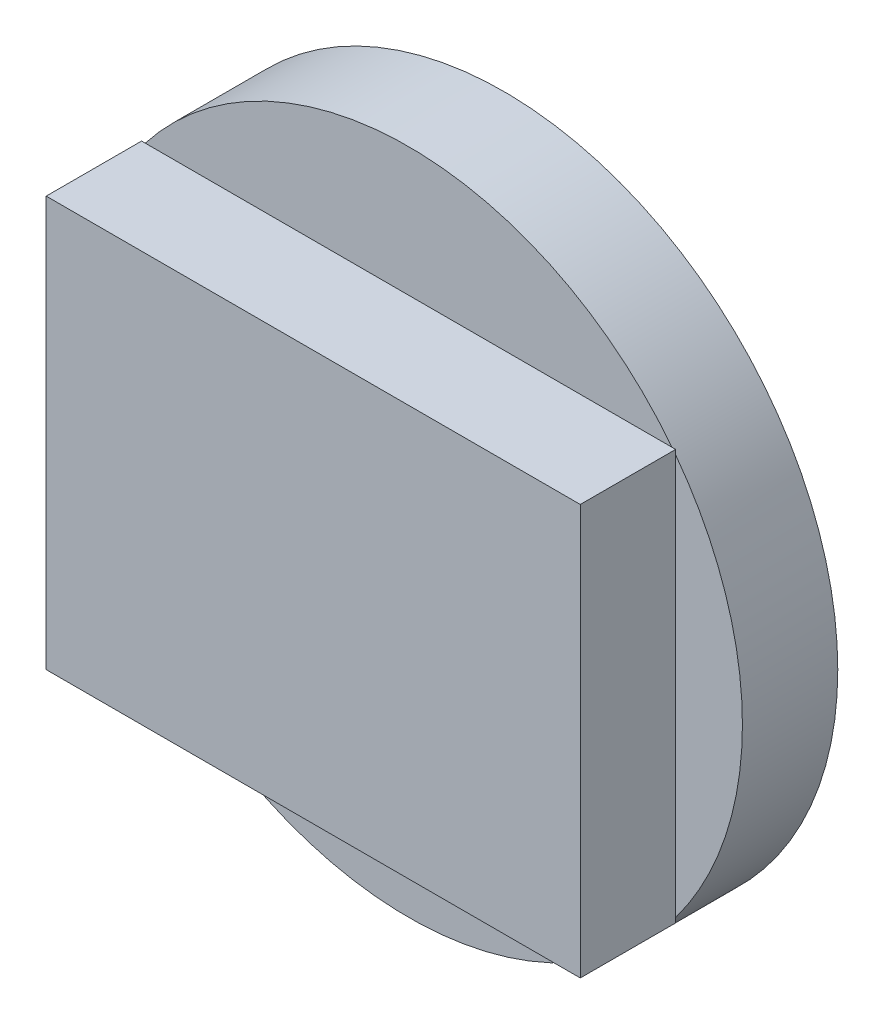
from build123d import *

# Parameters (mm, degrees)
ESQUISSE1_W        = 5.6
ESQUISSE1_H        = 4.3
BOSS_EXTRU_1_DEPTH = 1
ESQUISSE2_R        = 3.5
BOSS_EXTRU_2_DEPTH = 1


with BuildPart() as part:
    # Esquisse1 → Boss.-Extru.1 (new body)
    with BuildSketch(Plane.XY):
        with Locations((-3.465276253, 2.683333333)):
            Rectangle(ESQUISSE1_W, ESQUISSE1_H)
    extrude(amount=BOSS_EXTRU_1_DEPTH)

    # Esquisse2 → Boss.-Extru.2 (add)
    with BuildSketch(Plane.XY):
        with Locations((-3.465276253, 2.683333333)):
            Circle(ESQUISSE2_R)
    extrude(amount=-BOSS_EXTRU_2_DEPTH)


solid = part.part
